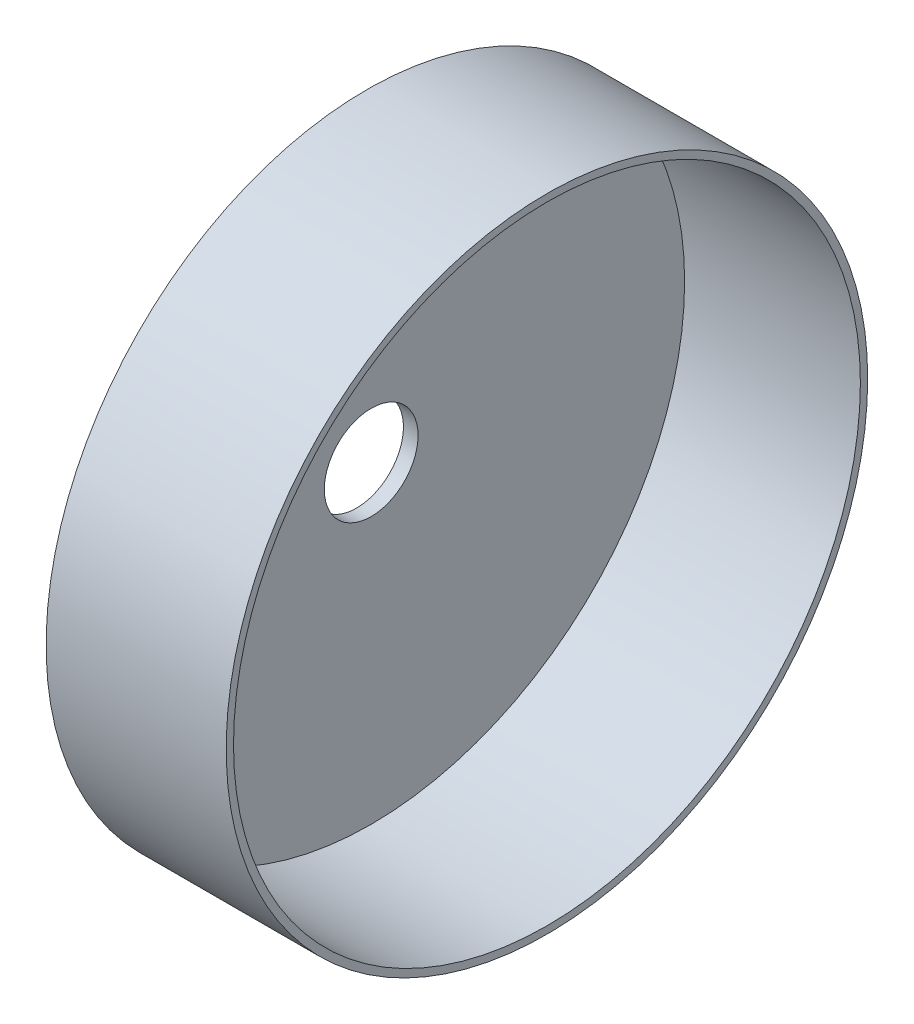
from build123d import *

# Parameters (mm, degrees)
SKETCH1_R           = 21.9
BOSS_EXTRUDE1_DEPTH = 1
SKETCH2_R           = 21.9
SKETCH2_R_2         = 21.4
BOSS_EXTRUDE2_DEPTH = 12
SKETCH3_R           = 3.2
CUT_EXTRUDE1_DEPTH  = 12
CHAMFER1_SIZE       = 4
CHAMFER1_SIZE2      = 0.705307923


with BuildPart() as part:
    # Sketch1 → Boss-Extrude1 (new body)
    with BuildSketch(Plane.YZ):
        with Locations(Location((0, 0, 0), (0, 0, 270))):
            Circle(SKETCH1_R)
    extrude(amount=BOSS_EXTRUDE1_DEPTH)

    # Sketch2 → Boss-Extrude2 (add)
    with BuildSketch(Plane.YZ.offset(1)):
        with Locations(Location((0, 0, 0), (0, 0, 270))):
            Circle(SKETCH2_R)
        with Locations(Location((0, 0, 0), (0, 0, 270))):
            Circle(SKETCH2_R_2, mode=Mode.SUBTRACT)
    extrude(amount=BOSS_EXTRUDE2_DEPTH)

    # Sketch3 → Cut-Extrude1 (cut)
    with BuildSketch(Plane(origin=(0, 0, 0), x_dir=(0, -1, 0), z_dir=(-1, 0, 0))):
        with Locations(Location((0, 0, 0), (0, 0, 90))):
            Circle(SKETCH3_R)
    extrude(amount=-CUT_EXTRUDE1_DEPTH, mode=Mode.SUBTRACT)

    # Chamfer1
    chamfer1_edges = [part.edges().sort_by_distance(p)[0] for p in [
        (0, 0, 21.9),
    ]]
    chamfer1_side = [part.faces().sort_by_distance(p)[0] for p in [
        (0, 0, 21.28057446),
    ]]
    chamfer(chamfer1_edges, length=CHAMFER1_SIZE, length2=CHAMFER1_SIZE2, reference=chamfer1_side[0])


solid = part.part
